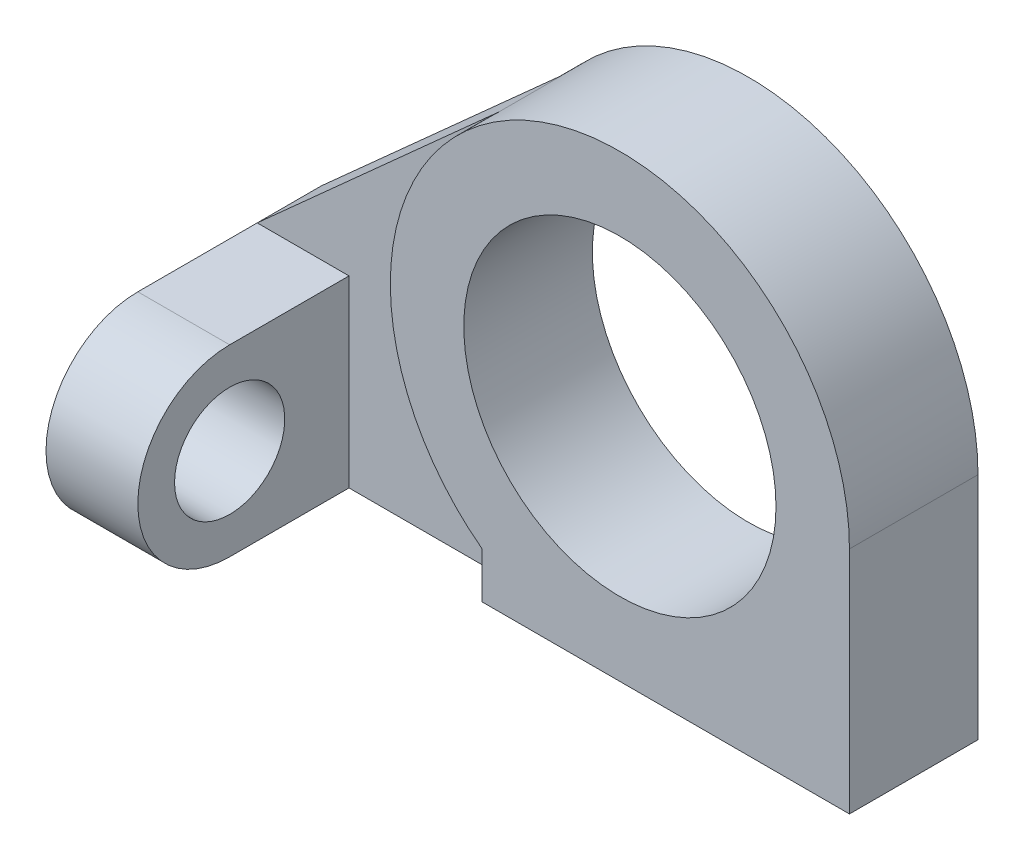
from build123d import *

# Parameters (mm, degrees)
SKETCH1_R           = 17
BOSS_EXTRUDE1_DEPTH = 3.5
SKETCH3_R           = 17
BOSS_EXTRUDE2_DEPTH = 3.5
SKETCH4_R           = 6
BOSS_EXTRUDE3_DEPTH = 10


with BuildPart() as part:
    # Sketch1 → Boss-Extrude1 (new, symmetric)
    with BuildSketch(Plane.XY):
        with BuildLine():
            Line((25, 0), (25, -25))
            Line((25, -25), (-47, -25))
            Line((-47, -25), (-47, -9))
            Line((-47, -9), (-43, -9))
            Line((-43, -9), (-43, -5))
            Line((-43, -5), (-16.69831871, 18.605540902))
            ThreePointArc((-16.69831871, 18.605540902), (10.186805983, 22.830439853), (25, 0))
        make_face()
        Circle(SKETCH1_R, mode=Mode.SUBTRACT)
    extrude(amount=BOSS_EXTRUDE1_DEPTH, both=True)

    # Sketch3 → Boss-Extrude2 (add)
    with BuildSketch(Plane.XY.offset(3.5)):
        with BuildLine():
            Line((25, -25), (25, 0))
            ThreePointArc((25, 0), (-11.180339887, 22.360679775), (-15, -20))
            Line((-15, -20), (-15, -25))
            Line((-15, -25), (25, -25))
        make_face()
        Circle(SKETCH3_R, mode=Mode.SUBTRACT)
    boss_extrude2 = extrude(amount=BOSS_EXTRUDE2_DEPTH)

    # Mirror1: Boss-Extrude2 across plane
    add(boss_extrude2.mirror(Plane.XY))

    # Sketch4 → Boss-Extrude3 (add)
    with BuildSketch(Plane.ZY.offset(43)):
        with BuildLine():
            Line((3.5, -5), (16.5, -5))
            ThreePointArc((16.5, -5), (26.5, -15), (16.5, -25))
            Line((16.5, -25), (3.5, -25))
            Line((3.5, -25), (3.5, -5))
        make_face()
        with Locations((16.5, -15)):
            Circle(SKETCH4_R, mode=Mode.SUBTRACT)
    extrude(amount=-BOSS_EXTRUDE3_DEPTH)


solid = part.part
